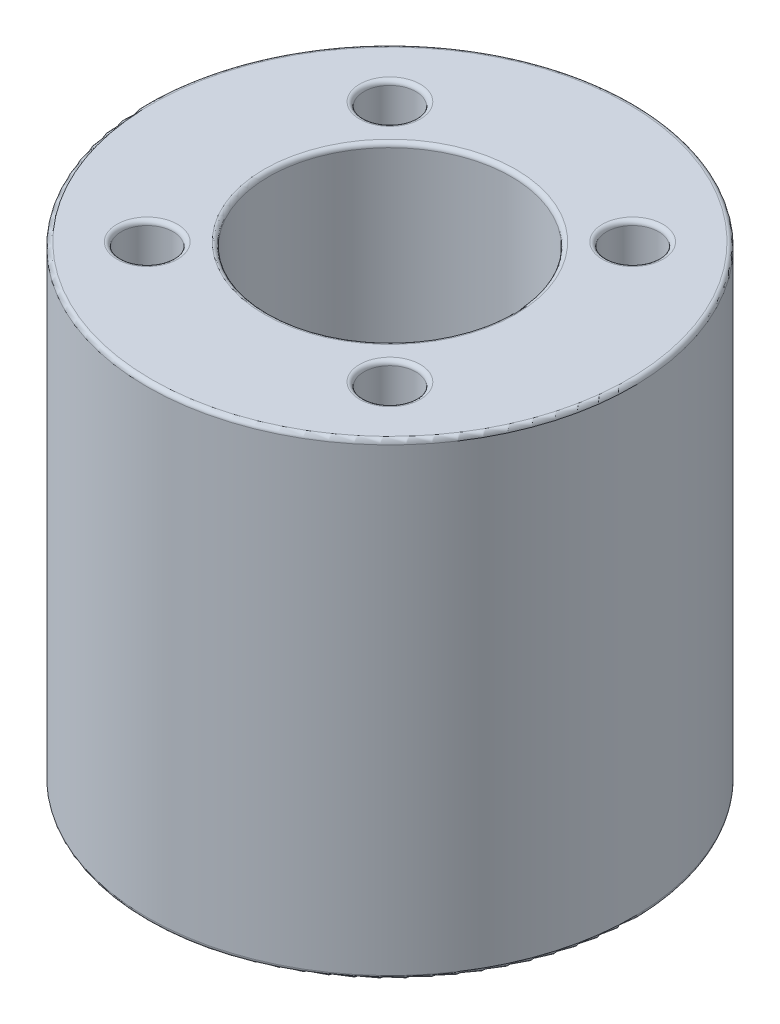
from build123d import *

# Parameters (mm, degrees)
SKETCH1_R           = 14
BOSS_EXTRUDE1_DEPTH = 27
SKETCH2_R           = 4
CUT_EXTRUDE1_DEPTH  = 27
SKETCH3_R           = 7
CUT_EXTRUDE2_DEPTH  = 12
FILLET1_R           = 0.25
SKETCH4_R           = 1.5
CUT_EXTRUDE3_DEPTH  = 5.5
FILLET2_R           = 0.25


with BuildPart() as part:
    # Sketch1 → Boss-Extrude1 (new body)
    with BuildSketch(Plane(origin=(0, 0, 0), x_dir=(1, 0, 0), z_dir=(0, 1, 0))):
        with Locations(Location((0, 0, 0), (0, 0, 270))):
            Circle(SKETCH1_R)
    extrude(amount=BOSS_EXTRUDE1_DEPTH)

    # Sketch2 → Cut-Extrude1 (cut)
    with BuildSketch(Plane(origin=(0, 27, 0), x_dir=(1, 0, 0), z_dir=(0, 1, 0))):
        with Locations(Location((0, 0, 0), (0, 0, 270))):
            Circle(SKETCH2_R)
    extrude(amount=-CUT_EXTRUDE1_DEPTH, mode=Mode.SUBTRACT)

    # Sketch3 → Cut-Extrude2 (cut)
    with BuildSketch(Plane(origin=(0, 27, 0), x_dir=(1, 0, 0), z_dir=(0, 1, 0))):
        with Locations(Location((0, 0, 0), (0, 0, 270))):
            Circle(SKETCH3_R)
    extrude(amount=-CUT_EXTRUDE2_DEPTH, mode=Mode.SUBTRACT)

    # Fillet1
    fillet1_edges = [part.edges().sort_by_distance(p)[0] for p in [
        (0, 27, -7),
        (0, 15, -7),
        (0, 15, -4),
        (0, 0, -14),
        (0, 27, -14),
        (0, 0, -4),
    ]]
    fillet(fillet1_edges, radius=FILLET1_R)

    # Sketch4 → Cut-Extrude3 (cut)
    with BuildSketch(Plane(origin=(0, 27, 0), x_dir=(1, 0, 0), z_dir=(0, 1, 0))):
        with Locations(Location((-7, 7, 0), (0, 0, 270))):
            Circle(SKETCH4_R)
        with Locations(Location((7, 7, 0), (0, 0, 270))):
            Circle(SKETCH4_R)
        with Locations(Location((-7, -7, 0), (0, 0, 270))):
            Circle(SKETCH4_R)
        with Locations(Location((7, -7, 0), (0, 0, 270))):
            Circle(SKETCH4_R)
    extrude(amount=-CUT_EXTRUDE3_DEPTH, mode=Mode.SUBTRACT)

    # Fillet2
    fillet2_edges = [part.edges().sort_by_distance(p)[0] for p in [
        (7, 21.5, -8.5),
        (7, 27, -8.5),
        (-7, 21.5, 5.5),
        (-7, 27, 5.5),
        (7, 21.5, 5.5),
        (7, 27, 5.5),
        (-7, 21.5, -8.5),
        (-7, 27, -8.5),
    ]]
    fillet(fillet2_edges, radius=FILLET2_R)


solid = part.part
